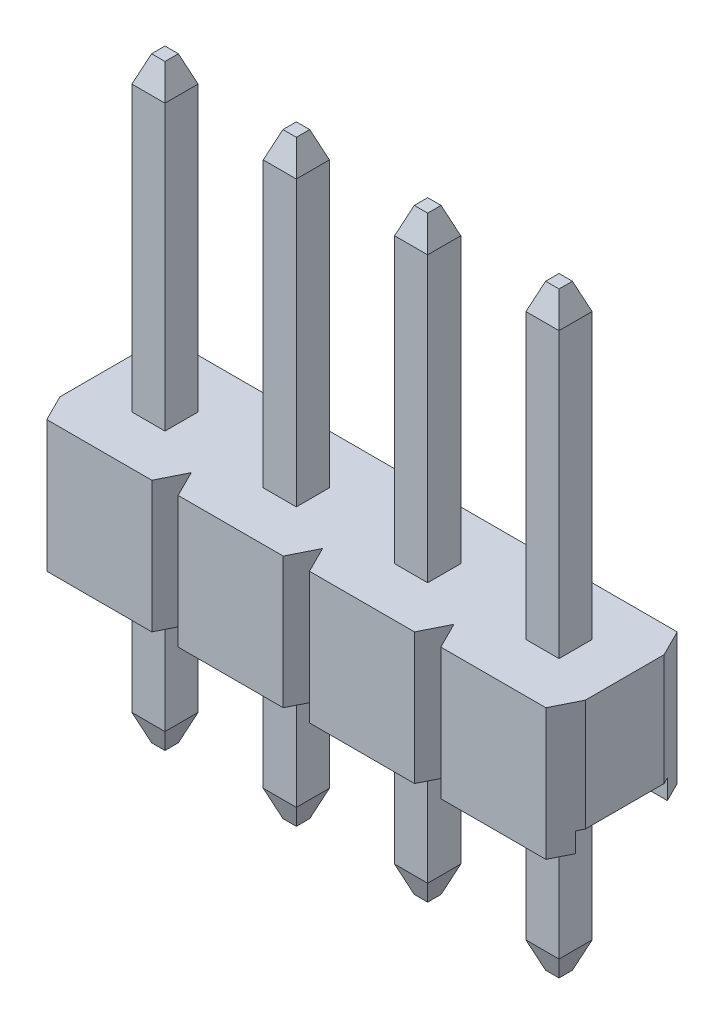
from build123d import *
from OCP.BRepFilletAPI import BRepFilletAPI_MakeChamfer

# Parameters (mm, degrees)
SKETCH1_W                     = 2.54
SKETCH1_H                     = 2.54
MAIN_BODY_DEPTH               = 2.54
SKETCH3_W                     = 1.778
SKETCH3_H                     = 0.381
CUT_EXTRUDE1_DEPTH            = 5.399409051
CUT_EXTRUDE2_DEPTH            = 5.399409051
BODY_PATTERN_COUNT            = 4
BODY_PATTERN_PITCH            = 2.54
PIN_START                     = -5.54
SKETCH2_W                     = 0.64
SKETCH2_H                     = 0.64
PIN_DEPTH                     = 11.54
CHAMFER1_SIZE                 = 0.508
CHAMFER1_SIZE2                = 0.1905
CHAMFER2_SIZE                 = 0.1905
CHAMFER2_SIZE2                = 0.508
PIN_PATTERN_COUNT             = 4
PIN_PATTERN_PITCH             = 2.54
CHAMFER1_OF_PIN_PATTERN_SIZE  = 0.508
CHAMFER1_OF_PIN_PATTERN_SIZE2 = 0.1905
CHAMFER2_OF_PIN_PATTERN_SIZE2 = 0.1905
CHAMFER2_OF_PIN_PATTERN_SIZE  = 0.508


with BuildPart() as part:
    # Sketch1 → Main Body (new body)
    with BuildSketch(Plane(origin=(0, 0, 0), x_dir=(1, 0, 0), z_dir=(0, 1, 0))):
        with Locations((1.27, 1.27)):
            Rectangle(SKETCH1_W, SKETCH1_H)
    main_body = extrude(amount=MAIN_BODY_DEPTH)

    # Sketch3 → Cut-Extrude1 (cut, through all)
    with BuildSketch(Plane.ZY):
        with Locations((-1.27, 0.1905)):
            Rectangle(SKETCH3_W, SKETCH3_H)
    cut_extrude1 = extrude(amount=-CUT_EXTRUDE1_DEPTH, mode=Mode.SUBTRACT)

    # Sketch4 → Cut-Extrude2 (cut, through all)
    with BuildSketch(Plane(origin=(0, 2.54, 0), x_dir=(1, 0, 0), z_dir=(0, 1, 0))):
        Polygon((0.254, 2.54), (0, 2.54), (0, 2.032), align=None)
        Polygon((2.54, 2.54), (2.286, 2.54), (2.54, 2.032), align=None)
        Polygon((0.254, 0), (0, 0.508), (0, 0), align=None)
        Polygon((2.54, 0), (2.286, 0), (2.54, 0.508), align=None)
    cut_extrude2 = extrude(amount=-CUT_EXTRUDE2_DEPTH, mode=Mode.SUBTRACT)

    # Body Pattern: Main Body, Cut-Extrude1, Cut-Extrude2 ×4
    with Locations(*[(-i * BODY_PATTERN_PITCH, 0, 0) for i in range(1, BODY_PATTERN_COUNT)]):
        add(main_body)
        add(cut_extrude1, mode=Mode.SUBTRACT)
        add(cut_extrude2, mode=Mode.SUBTRACT)

    # Sketch2 → Pin (add)
    with BuildSketch(Plane(origin=(0, 2.54, 0), x_dir=(1, 0, 0), z_dir=(0, 1, 0)).offset(PIN_START)):
        with Locations((1.27, 1.27)):
            Rectangle(SKETCH2_W, SKETCH2_H)
    pin = extrude(amount=PIN_DEPTH)

    # Chamfer1: one chamfer whose edges measure the first distance from different faces: ONE call of the kernel's chamfer builder (chamfer() names one face for all edges)
    chamfer1_edges_1 = [part.edges().sort_by_distance(p)[0] for p in [
        (0.95, 8.54, -1.27),
    ]]
    chamfer1_side_1 = [part.faces().sort_by_distance(p)[0] for p in [
        (0.95, 5.54, -1.27),
    ]]
    chamfer1_edges_2 = [part.edges().sort_by_distance(p)[0] for p in [
        (1.27, 8.54, -0.95),
    ]]
    chamfer1_side_2 = [part.faces().sort_by_distance(p)[0] for p in [
        (1.27, 5.54, -0.95),
    ]]
    chamfer1_edges_3 = [part.edges().sort_by_distance(p)[0] for p in [
        (1.59, 8.54, -1.27),
    ]]
    chamfer1_side_3 = [part.faces().sort_by_distance(p)[0] for p in [
        (1.59, 5.54, -1.27),
    ]]
    chamfer1_edges_4 = [part.edges().sort_by_distance(p)[0] for p in [
        (1.27, 8.54, -1.59),
    ]]
    chamfer1_side_4 = [part.faces().sort_by_distance(p)[0] for p in [
        (1.27, 5.54, -1.59),
    ]]
    chamfer1 = BRepFilletAPI_MakeChamfer(part.part.solid().wrapped)
    for e in chamfer1_edges_1:
        chamfer1.Add(CHAMFER1_SIZE, CHAMFER1_SIZE2, e.wrapped, chamfer1_side_1[0].wrapped)  # the first distance lies on this face
    for e in chamfer1_edges_2:
        chamfer1.Add(CHAMFER1_SIZE, CHAMFER1_SIZE2, e.wrapped, chamfer1_side_2[0].wrapped)  # the first distance lies on this face
    for e in chamfer1_edges_3:
        chamfer1.Add(CHAMFER1_SIZE, CHAMFER1_SIZE2, e.wrapped, chamfer1_side_3[0].wrapped)  # the first distance lies on this face
    for e in chamfer1_edges_4:
        chamfer1.Add(CHAMFER1_SIZE, CHAMFER1_SIZE2, e.wrapped, chamfer1_side_4[0].wrapped)  # the first distance lies on this face
    add(Compound.cast(chamfer1.Shape()), mode=Mode.REPLACE)

    # Chamfer2
    chamfer2_edges = [part.edges().sort_by_distance(p)[0] for p in [
        (1.27, -3, -0.95),
        (1.59, -3, -1.27),
        (1.27, -3, -1.59),
        (0.95, -3, -1.27),
    ]]
    chamfer2_side = [part.faces().sort_by_distance(p)[0] for p in [
        (1.27, -3, -1.27),
    ]]
    chamfer(chamfer2_edges, length=CHAMFER2_SIZE, length2=CHAMFER2_SIZE2, reference=chamfer2_side[0])

    # Pin Pattern: Pin ×4
    with Locations(*[(-i * PIN_PATTERN_PITCH, 0, 0) for i in range(1, PIN_PATTERN_COUNT)]):
        add(pin)

    # Chamfer1 of Pin Pattern: one chamfer whose edges measure the first distance from different faces: ONE call of the kernel's chamfer builder (chamfer() names one face for all edges)
    chamfer1_of_pin_pattern_edges_1 = [part.edges().sort_by_distance(p)[0] for p in [
        (-1.59, 8.54, -1.27),
    ]]
    chamfer1_of_pin_pattern_side_1 = [part.faces().sort_by_distance(p)[0] for p in [
        (-1.59, 5.54, -1.27),
    ]]
    chamfer1_of_pin_pattern_edges_2 = [part.edges().sort_by_distance(p)[0] for p in [
        (-1.27, 8.54, -0.95),
    ]]
    chamfer1_of_pin_pattern_side_2 = [part.faces().sort_by_distance(p)[0] for p in [
        (-1.27, 5.54, -0.95),
    ]]
    chamfer1_of_pin_pattern_edges_3 = [part.edges().sort_by_distance(p)[0] for p in [
        (-0.95, 8.54, -1.27),
    ]]
    chamfer1_of_pin_pattern_side_3 = [part.faces().sort_by_distance(p)[0] for p in [
        (-0.95, 5.54, -1.27),
    ]]
    chamfer1_of_pin_pattern_edges_4 = [part.edges().sort_by_distance(p)[0] for p in [
        (-1.27, 8.54, -1.59),
    ]]
    chamfer1_of_pin_pattern_side_4 = [part.faces().sort_by_distance(p)[0] for p in [
        (-1.27, 5.54, -1.59),
    ]]
    chamfer1_of_pin_pattern_edges_5 = [part.edges().sort_by_distance(p)[0] for p in [
        (-4.13, 8.54, -1.27),
    ]]
    chamfer1_of_pin_pattern_side_5 = [part.faces().sort_by_distance(p)[0] for p in [
        (-4.13, 5.54, -1.27),
    ]]
    chamfer1_of_pin_pattern_edges_6 = [part.edges().sort_by_distance(p)[0] for p in [
        (-3.81, 8.54, -0.95),
    ]]
    chamfer1_of_pin_pattern_side_6 = [part.faces().sort_by_distance(p)[0] for p in [
        (-3.81, 5.54, -0.95),
    ]]
    chamfer1_of_pin_pattern_edges_7 = [part.edges().sort_by_distance(p)[0] for p in [
        (-3.49, 8.54, -1.27),
    ]]
    chamfer1_of_pin_pattern_side_7 = [part.faces().sort_by_distance(p)[0] for p in [
        (-3.49, 5.54, -1.27),
    ]]
    chamfer1_of_pin_pattern_edges_8 = [part.edges().sort_by_distance(p)[0] for p in [
        (-3.81, 8.54, -1.59),
    ]]
    chamfer1_of_pin_pattern_side_8 = [part.faces().sort_by_distance(p)[0] for p in [
        (-3.81, 5.54, -1.59),
    ]]
    chamfer1_of_pin_pattern_edges_9 = [part.edges().sort_by_distance(p)[0] for p in [
        (-6.67, 8.54, -1.27),
    ]]
    chamfer1_of_pin_pattern_side_9 = [part.faces().sort_by_distance(p)[0] for p in [
        (-6.67, 5.54, -1.27),
    ]]
    chamfer1_of_pin_pattern_edges_10 = [part.edges().sort_by_distance(p)[0] for p in [
        (-6.35, 8.54, -0.95),
    ]]
    chamfer1_of_pin_pattern_side_10 = [part.faces().sort_by_distance(p)[0] for p in [
        (-6.35, 5.54, -0.95),
    ]]
    chamfer1_of_pin_pattern_edges_11 = [part.edges().sort_by_distance(p)[0] for p in [
        (-6.03, 8.54, -1.27),
    ]]
    chamfer1_of_pin_pattern_side_11 = [part.faces().sort_by_distance(p)[0] for p in [
        (-6.03, 5.54, -1.27),
    ]]
    chamfer1_of_pin_pattern_edges_12 = [part.edges().sort_by_distance(p)[0] for p in [
        (-6.35, 8.54, -1.59),
    ]]
    chamfer1_of_pin_pattern_side_12 = [part.faces().sort_by_distance(p)[0] for p in [
        (-6.35, 5.54, -1.59),
    ]]
    chamfer1_of_pin_pattern = BRepFilletAPI_MakeChamfer(part.part.solid().wrapped)
    for e in chamfer1_of_pin_pattern_edges_1:
        chamfer1_of_pin_pattern.Add(CHAMFER1_OF_PIN_PATTERN_SIZE, CHAMFER1_OF_PIN_PATTERN_SIZE2, e.wrapped, chamfer1_of_pin_pattern_side_1[0].wrapped)  # the first distance lies on this face
    for e in chamfer1_of_pin_pattern_edges_2:
        chamfer1_of_pin_pattern.Add(CHAMFER1_OF_PIN_PATTERN_SIZE, CHAMFER1_OF_PIN_PATTERN_SIZE2, e.wrapped, chamfer1_of_pin_pattern_side_2[0].wrapped)  # the first distance lies on this face
    for e in chamfer1_of_pin_pattern_edges_3:
        chamfer1_of_pin_pattern.Add(CHAMFER1_OF_PIN_PATTERN_SIZE, CHAMFER1_OF_PIN_PATTERN_SIZE2, e.wrapped, chamfer1_of_pin_pattern_side_3[0].wrapped)  # the first distance lies on this face
    for e in chamfer1_of_pin_pattern_edges_4:
        chamfer1_of_pin_pattern.Add(CHAMFER1_OF_PIN_PATTERN_SIZE, CHAMFER1_OF_PIN_PATTERN_SIZE2, e.wrapped, chamfer1_of_pin_pattern_side_4[0].wrapped)  # the first distance lies on this face
    for e in chamfer1_of_pin_pattern_edges_5:
        chamfer1_of_pin_pattern.Add(CHAMFER1_OF_PIN_PATTERN_SIZE, CHAMFER1_OF_PIN_PATTERN_SIZE2, e.wrapped, chamfer1_of_pin_pattern_side_5[0].wrapped)  # the first distance lies on this face
    for e in chamfer1_of_pin_pattern_edges_6:
        chamfer1_of_pin_pattern.Add(CHAMFER1_OF_PIN_PATTERN_SIZE, CHAMFER1_OF_PIN_PATTERN_SIZE2, e.wrapped, chamfer1_of_pin_pattern_side_6[0].wrapped)  # the first distance lies on this face
    for e in chamfer1_of_pin_pattern_edges_7:
        chamfer1_of_pin_pattern.Add(CHAMFER1_OF_PIN_PATTERN_SIZE, CHAMFER1_OF_PIN_PATTERN_SIZE2, e.wrapped, chamfer1_of_pin_pattern_side_7[0].wrapped)  # the first distance lies on this face
    for e in chamfer1_of_pin_pattern_edges_8:
        chamfer1_of_pin_pattern.Add(CHAMFER1_OF_PIN_PATTERN_SIZE, CHAMFER1_OF_PIN_PATTERN_SIZE2, e.wrapped, chamfer1_of_pin_pattern_side_8[0].wrapped)  # the first distance lies on this face
    for e in chamfer1_of_pin_pattern_edges_9:
        chamfer1_of_pin_pattern.Add(CHAMFER1_OF_PIN_PATTERN_SIZE, CHAMFER1_OF_PIN_PATTERN_SIZE2, e.wrapped, chamfer1_of_pin_pattern_side_9[0].wrapped)  # the first distance lies on this face
    for e in chamfer1_of_pin_pattern_edges_10:
        chamfer1_of_pin_pattern.Add(CHAMFER1_OF_PIN_PATTERN_SIZE, CHAMFER1_OF_PIN_PATTERN_SIZE2, e.wrapped, chamfer1_of_pin_pattern_side_10[0].wrapped)  # the first distance lies on this face
    for e in chamfer1_of_pin_pattern_edges_11:
        chamfer1_of_pin_pattern.Add(CHAMFER1_OF_PIN_PATTERN_SIZE, CHAMFER1_OF_PIN_PATTERN_SIZE2, e.wrapped, chamfer1_of_pin_pattern_side_11[0].wrapped)  # the first distance lies on this face
    for e in chamfer1_of_pin_pattern_edges_12:
        chamfer1_of_pin_pattern.Add(CHAMFER1_OF_PIN_PATTERN_SIZE, CHAMFER1_OF_PIN_PATTERN_SIZE2, e.wrapped, chamfer1_of_pin_pattern_side_12[0].wrapped)  # the first distance lies on this face
    add(Compound.cast(chamfer1_of_pin_pattern.Shape()), mode=Mode.REPLACE)

    # Chamfer2 of Pin Pattern
    chamfer2_of_pin_pattern_edges = [part.edges().sort_by_distance(p)[0] for p in [
        (-1.27, -3, -0.95),
        (-0.95, -3, -1.27),
        (-1.27, -3, -1.59),
        (-1.59, -3, -1.27),
        (-3.81, -3, -0.95),
        (-3.49, -3, -1.27),
        (-3.81, -3, -1.59),
        (-4.13, -3, -1.27),
        (-6.35, -3, -0.95),
        (-6.03, -3, -1.27),
        (-6.35, -3, -1.59),
        (-6.67, -3, -1.27),
    ]]
    chamfer(chamfer2_of_pin_pattern_edges, length=CHAMFER2_OF_PIN_PATTERN_SIZE, length2=CHAMFER2_OF_PIN_PATTERN_SIZE2)


solid = part.part
